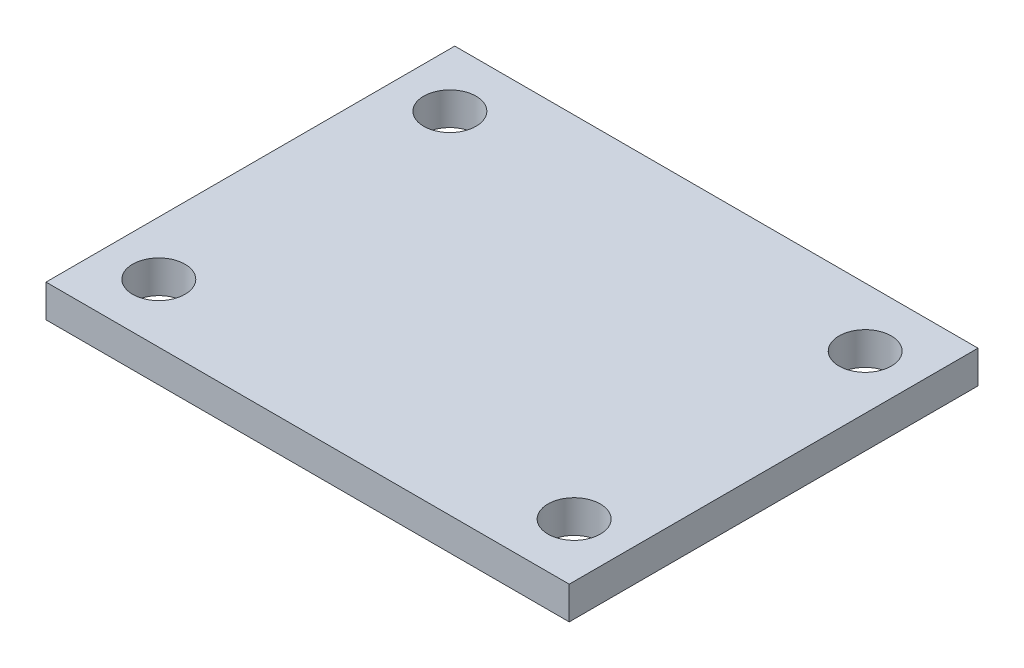
from build123d import *

# Parameters (mm, degrees)
SKETCH1_W           = 32
SKETCH1_H           = 25
BOSS_EXTRUDE1_DEPTH = 2
SKETCH2_R           = 1.6
CUT_EXTRUDE1_DEPTH  = 21.402205763


with BuildPart() as part:
    # Sketch1 → Boss-Extrude1 (new body)
    with BuildSketch(Plane(origin=(0, 0, 0), x_dir=(1, 0, 0), z_dir=(0, 1, 0))):
        Rectangle(SKETCH1_W, SKETCH1_H)
    extrude(amount=BOSS_EXTRUDE1_DEPTH)

    # Sketch2 → Cut-Extrude1 (cut, through all)
    with BuildSketch(Plane(origin=(0, 0, 0), x_dir=(1, 0, 0), z_dir=(0, 1, 0))):
        with Locations(Location((-12.7, 8.9, 0), (0, 0, 270))):
            Circle(SKETCH2_R)
        with Locations(Location((-12.7, -8.9, 0), (0, 0, 270))):
            Circle(SKETCH2_R)
        with Locations(Location((12.7, 8.9, 0), (0, 0, 270))):
            Circle(SKETCH2_R)
        with Locations(Location((12.7, -8.9, 0), (0, 0, 270))):
            Circle(SKETCH2_R)
    extrude(amount=CUT_EXTRUDE1_DEPTH, mode=Mode.SUBTRACT)


solid = part.part
